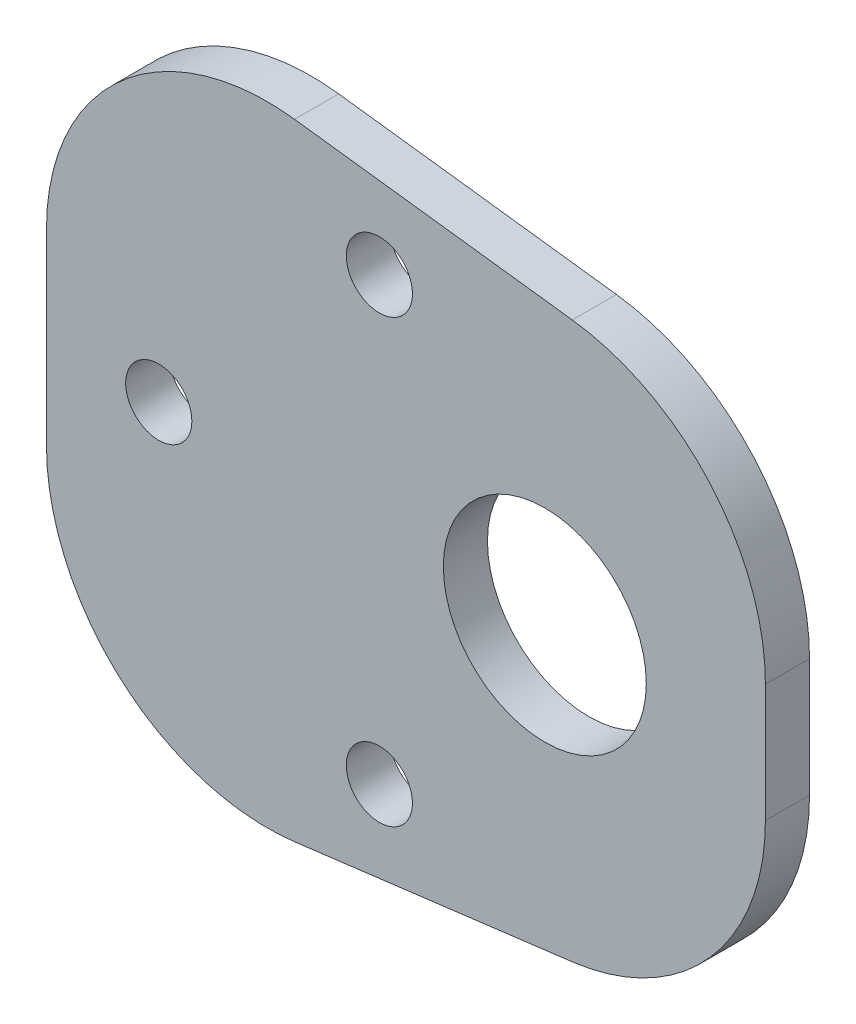
from build123d import *

# Parameters (mm, degrees)
SKETCH_1_R      = 1.5
SKETCH_1_R_2    = 4.6
EXTRUDE_1_DEPTH = 2


with BuildPart() as part:
    # 草图1 → 凸台-拉伸1 (new body)
    with BuildSketch(Plane.XY):
        with BuildLine():
            Line((-3.753096947, 12.600241703), (-16.343310644, 14.181172272))
            ThreePointArc((-16.343310644, 14.181172272), (-24.205137287, 11.757721557), (-27.589208865, 4.259088942))
            Line((-27.589208865, 4.259088942), (-27.589208865, -4.259088942))
            ThreePointArc((-27.589208865, -4.259088942), (-24.205137287, -11.757721557), (-16.343310644, -14.181172272))
            Line((-16.343310644, -14.181172272), (-3.753096947, -12.600241703))
            ThreePointArc((-3.753096947, -12.600241703), (2.499637447, -9.294086795), (5.001004832, -2.678158372))
            Line((5.001004832, -2.678158372), (5.001004832, 2.678158372))
            ThreePointArc((5.001004832, 2.678158372), (2.499637447, 9.294086795), (-3.753096947, 12.600241703))
        make_face()
        with Locations((-12.498995168, 10)):
            Circle(SKETCH_1_R, mode=Mode.SUBTRACT)
        with Locations((-4.998995168, 0)):
            Circle(SKETCH_1_R_2, mode=Mode.SUBTRACT)
        with Locations((-12.498995168, -10)):
            Circle(SKETCH_1_R, mode=Mode.SUBTRACT)
        with Locations((-22.498995168, 0)):
            Circle(SKETCH_1_R, mode=Mode.SUBTRACT)
    extrude(amount=EXTRUDE_1_DEPTH)


solid = part.part
